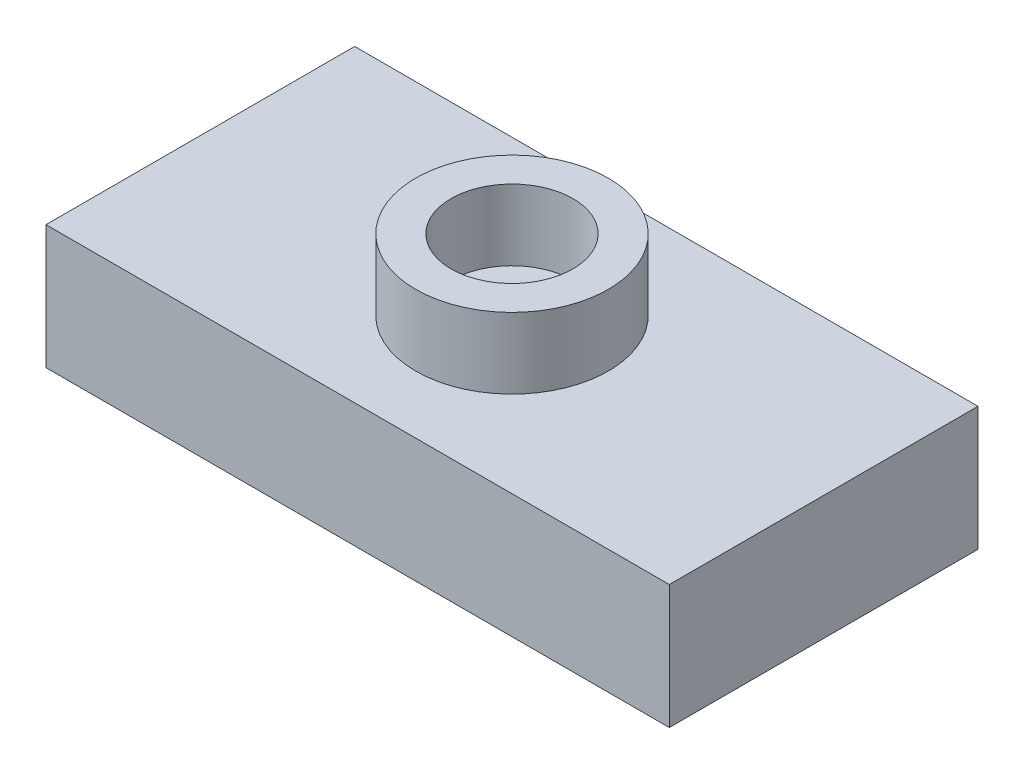
from build123d import *

# Parameters (mm, degrees)
SKETCH1_W           = 15.85
SKETCH1_H           = 7.85
BOSS_EXTRUDE1_DEPTH = 3.15
SHELL1_T            = -1.5
SKETCH2_R           = 2.45
SKETCH2_R_2         = 1.55
BOSS_EXTRUDE2_DEPTH = 1.8


with BuildPart() as part:
    # Sketch1 → Boss-Extrude1 (new body)
    with BuildSketch(Plane(origin=(0, 0, 0), x_dir=(1, 0, 0), z_dir=(0, 1, 0))):
        Rectangle(SKETCH1_W, SKETCH1_H)
    extrude(amount=-BOSS_EXTRUDE1_DEPTH)

    # Shell1
    shell1_openings = [part.faces().sort_by_distance(p)[0] for p in [
        (0, -3.15, 0),
    ]]
    offset(amount=SHELL1_T, openings=shell1_openings, kind=Kind.INTERSECTION)

    # Sketch2 → Boss-Extrude2 (add)
    with BuildSketch(Plane(origin=(0, 0, 0), x_dir=(1, 0, 0), z_dir=(0, 1, 0))):
        with Locations(Location((0, 0, 0), (0, 0, 270))):
            Circle(SKETCH2_R)
        with Locations(Location((0, 0, 0), (0, 0, 270))):
            Circle(SKETCH2_R_2, mode=Mode.SUBTRACT)
    extrude(amount=BOSS_EXTRUDE2_DEPTH)


solid = part.part
